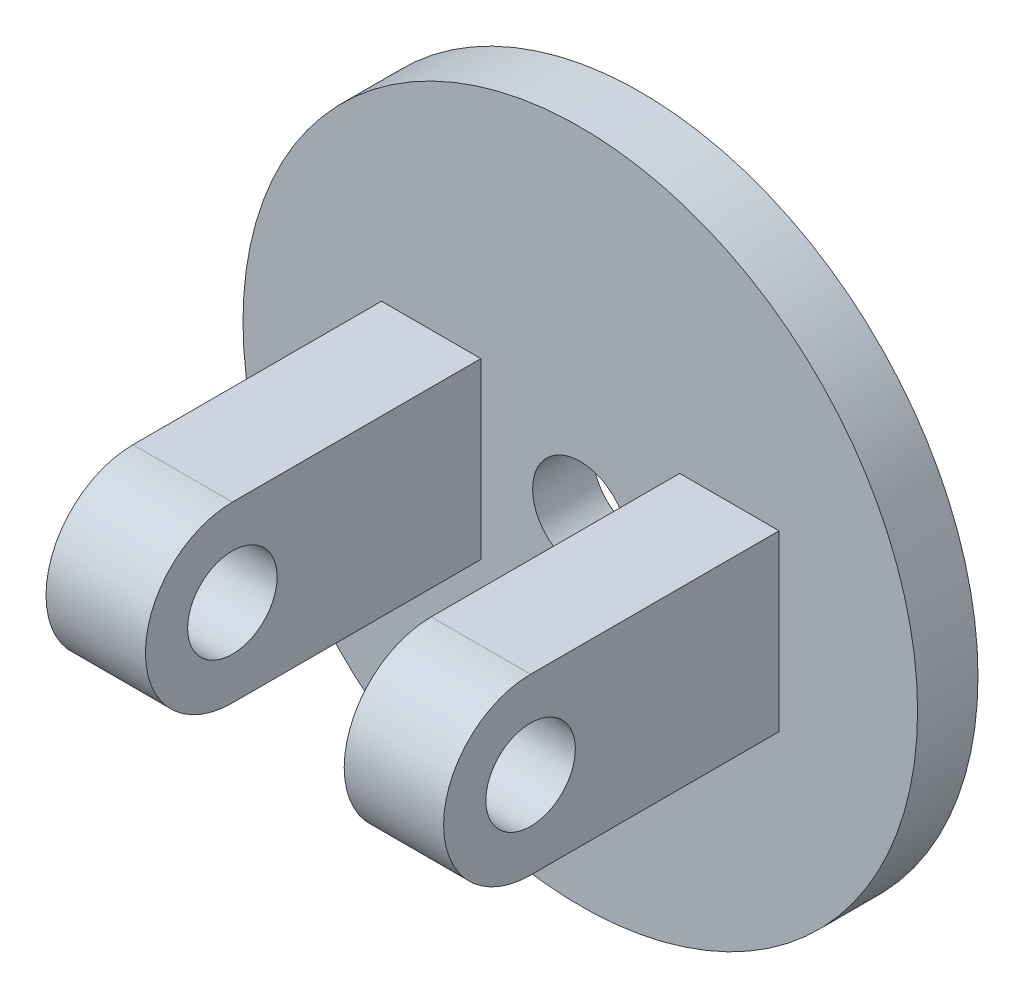
from build123d import *

# Parameters (mm, degrees)
SKETCH5_R            = 9.589935832
CUT_EXTRUDE1_DEPTH   = 40
BOSS_EXTRUDE8_DEPTH  = 60
CIRPATTERN8_COUNT    = 24
SKETCH18_W           = 20
SKETCH18_H           = 35
BOSS_EXTRUDE9_DEPTH  = 50
SKETCH19_R           = 17.5
BOSS_EXTRUDE10_DEPTH = 20
SKETCH20_R           = 17.5
BOSS_EXTRUDE11_DEPTH = 20
SKETCH22_R           = 70
CUT_EXTRUDE3_DEPTH   = 65
SKETCH23_R           = 9
CUT_EXTRUDE4_DEPTH   = 90


with BuildPart() as part:
    # Sketch4 → Revolve1 (revolve)
    with BuildSketch(Plane(origin=(0, 0, 0), x_dir=(1, 0, 0), z_dir=(0, 1, 0))):
        Polygon((0, 0), (0, -18.450154162), (67.865602024, -18.450154162), (67.865602024, 58.705035971), (49.02838169, 58.705035971), (49.02838169, 0), align=None)
    revolve(axis=Axis((0, 0, -85.541623844), (0, 0, 1)))

    # Sketch5 → Cut-Extrude1 (cut)
    with BuildSketch(Plane(origin=(0, 0, 0), x_dir=(-1, 0, 0), z_dir=(0, 0, -1))):
        Circle(SKETCH5_R)
    extrude(amount=-CUT_EXTRUDE1_DEPTH, mode=Mode.SUBTRACT)

    # Sketch18 → Boss-Extrude9 (add)
    with BuildSketch(Plane.XY.offset(18.450154162)):
        with Locations((-30, 0)):
            Rectangle(SKETCH18_W, SKETCH18_H)
        with Locations((30, 0)):
            Rectangle(SKETCH18_W, SKETCH18_H)
    extrude(amount=BOSS_EXTRUDE9_DEPTH)

    # Sketch19 → Boss-Extrude10 (add)
    with BuildSketch(Plane(origin=(-20, 0, 0), x_dir=(0, 0, -1), z_dir=(1, 0, 0))):
        with Locations((-68.450154162, 0)):
            Circle(SKETCH19_R)
    extrude(amount=-BOSS_EXTRUDE10_DEPTH)

    # Sketch20 → Boss-Extrude11 (add)
    with BuildSketch(Plane(origin=(40, 0, 0), x_dir=(0, 0, -1), z_dir=(1, 0, 0))):
        with Locations((-68.450154162, 0)):
            Circle(SKETCH20_R)
    extrude(amount=-BOSS_EXTRUDE11_DEPTH)


with BuildPart() as body_2:
    # Sketch6 → Boss-Extrude8 (new body)
    with BuildSketch(Plane(origin=(0, 0, -58.705035971), x_dir=(-1, 0, 0), z_dir=(0, 0, -1))):
        Polygon((-8.362087214, 48.310016649), (-5.897089184, 44.631705328), (-3.61276171, 45.181148209), (-2.68200751, 48.954969583), align=None)
    extrude(amount=-BOSS_EXTRUDE8_DEPTH)


with BuildPart() as cirpattern8_1:
    # CirPattern8: pattern copy
    add(body_2.part.rotate(Axis((0, 0, 18.450154162), (0, 0, -1)), 1 * 360 / CIRPATTERN8_COUNT))


with BuildPart() as cirpattern8_2:
    # CirPattern8: pattern copy
    add(body_2.part.rotate(Axis((0, 0, 18.450154162), (0, 0, -1)), 2 * 360 / CIRPATTERN8_COUNT))


with BuildPart() as cirpattern8_3:
    # CirPattern8: pattern copy
    add(body_2.part.rotate(Axis((0, 0, 18.450154162), (0, 0, -1)), 3 * 360 / CIRPATTERN8_COUNT))


with BuildPart() as cirpattern8_4:
    # CirPattern8: pattern copy
    add(body_2.part.rotate(Axis((0, 0, 18.450154162), (0, 0, -1)), 4 * 360 / CIRPATTERN8_COUNT))


with BuildPart() as cirpattern8_5:
    # CirPattern8: pattern copy
    add(body_2.part.rotate(Axis((0, 0, 18.450154162), (0, 0, -1)), 5 * 360 / CIRPATTERN8_COUNT))


with BuildPart() as cirpattern8_6:
    # CirPattern8: pattern copy
    add(body_2.part.rotate(Axis((0, 0, 18.450154162), (0, 0, -1)), 6 * 360 / CIRPATTERN8_COUNT))


with BuildPart() as cirpattern8_7:
    # CirPattern8: pattern copy
    add(body_2.part.rotate(Axis((0, 0, 18.450154162), (0, 0, -1)), 7 * 360 / CIRPATTERN8_COUNT))


with BuildPart() as cirpattern8_8:
    # CirPattern8: pattern copy
    add(body_2.part.rotate(Axis((0, 0, 18.450154162), (0, 0, -1)), 8 * 360 / CIRPATTERN8_COUNT))


with BuildPart() as cirpattern8_9:
    # CirPattern8: pattern copy
    add(body_2.part.rotate(Axis((0, 0, 18.450154162), (0, 0, -1)), 9 * 360 / CIRPATTERN8_COUNT))


with BuildPart() as cirpattern8_10:
    # CirPattern8: pattern copy
    add(body_2.part.rotate(Axis((0, 0, 18.450154162), (0, 0, -1)), 10 * 360 / CIRPATTERN8_COUNT))


with BuildPart() as cirpattern8_11:
    # CirPattern8: pattern copy
    add(body_2.part.rotate(Axis((0, 0, 18.450154162), (0, 0, -1)), 11 * 360 / CIRPATTERN8_COUNT))


with BuildPart() as cirpattern8_12:
    # CirPattern8: pattern copy
    add(body_2.part.rotate(Axis((0, 0, 18.450154162), (0, 0, -1)), 12 * 360 / CIRPATTERN8_COUNT))


with BuildPart() as cirpattern8_13:
    # CirPattern8: pattern copy
    add(body_2.part.rotate(Axis((0, 0, 18.450154162), (0, 0, -1)), 13 * 360 / CIRPATTERN8_COUNT))


with BuildPart() as cirpattern8_14:
    # CirPattern8: pattern copy
    add(body_2.part.rotate(Axis((0, 0, 18.450154162), (0, 0, -1)), 14 * 360 / CIRPATTERN8_COUNT))


with BuildPart() as cirpattern8_15:
    # CirPattern8: pattern copy
    add(body_2.part.rotate(Axis((0, 0, 18.450154162), (0, 0, -1)), 15 * 360 / CIRPATTERN8_COUNT))


with BuildPart() as cirpattern8_16:
    # CirPattern8: pattern copy
    add(body_2.part.rotate(Axis((0, 0, 18.450154162), (0, 0, -1)), 16 * 360 / CIRPATTERN8_COUNT))


with BuildPart() as cirpattern8_17:
    # CirPattern8: pattern copy
    add(body_2.part.rotate(Axis((0, 0, 18.450154162), (0, 0, -1)), 17 * 360 / CIRPATTERN8_COUNT))


with BuildPart() as cirpattern8_18:
    # CirPattern8: pattern copy
    add(body_2.part.rotate(Axis((0, 0, 18.450154162), (0, 0, -1)), 18 * 360 / CIRPATTERN8_COUNT))


with BuildPart() as cirpattern8_19:
    # CirPattern8: pattern copy
    add(body_2.part.rotate(Axis((0, 0, 18.450154162), (0, 0, -1)), 19 * 360 / CIRPATTERN8_COUNT))


with BuildPart() as cirpattern8_20:
    # CirPattern8: pattern copy
    add(body_2.part.rotate(Axis((0, 0, 18.450154162), (0, 0, -1)), 20 * 360 / CIRPATTERN8_COUNT))


with BuildPart() as cirpattern8_21:
    # CirPattern8: pattern copy
    add(body_2.part.rotate(Axis((0, 0, 18.450154162), (0, 0, -1)), 21 * 360 / CIRPATTERN8_COUNT))


with BuildPart() as cirpattern8_22:
    # CirPattern8: pattern copy
    add(body_2.part.rotate(Axis((0, 0, 18.450154162), (0, 0, -1)), 22 * 360 / CIRPATTERN8_COUNT))


with BuildPart() as cirpattern8_23:
    # CirPattern8: pattern copy
    add(body_2.part.rotate(Axis((0, 0, 18.450154162), (0, 0, -1)), 23 * 360 / CIRPATTERN8_COUNT))


with BuildPart() as cut_extrude3_tool:
    # Sketch22 → Cut-Extrude3 (new body)
    with BuildSketch(Plane(origin=(0, 0, -58.705035971), x_dir=(-1, 0, 0), z_dir=(0, 0, -1))):
        Circle(SKETCH22_R)
    extrude(amount=-CUT_EXTRUDE3_DEPTH)


with BuildPart() as part_1:
    add(part.part)

    # Cut-Extrude3: cut by cut_extrude3_tool
    add(cut_extrude3_tool.part, mode=Mode.SUBTRACT)

    # Sketch23 → Cut-Extrude4 (cut)
    with BuildSketch(Plane(origin=(40, 0, 0), x_dir=(0, 0, -1), z_dir=(1, 0, 0))):
        with Locations((-68.450154162, 0)):
            Circle(SKETCH23_R)
    extrude(amount=-CUT_EXTRUDE4_DEPTH, mode=Mode.SUBTRACT)


with BuildPart() as body_2_1:
    add(body_2.part)

    # Cut-Extrude3: cut by cut_extrude3_tool
    add(cut_extrude3_tool.part, mode=Mode.SUBTRACT)


with BuildPart() as cirpattern8_1_1:
    add(cirpattern8_1.part)

    # Cut-Extrude3: cut by cut_extrude3_tool
    add(cut_extrude3_tool.part, mode=Mode.SUBTRACT)


with BuildPart() as cirpattern8_2_1:
    add(cirpattern8_2.part)

    # Cut-Extrude3: cut by cut_extrude3_tool
    add(cut_extrude3_tool.part, mode=Mode.SUBTRACT)


with BuildPart() as cirpattern8_3_1:
    add(cirpattern8_3.part)

    # Cut-Extrude3: cut by cut_extrude3_tool
    add(cut_extrude3_tool.part, mode=Mode.SUBTRACT)


with BuildPart() as cirpattern8_4_1:
    add(cirpattern8_4.part)

    # Cut-Extrude3: cut by cut_extrude3_tool
    add(cut_extrude3_tool.part, mode=Mode.SUBTRACT)


with BuildPart() as cirpattern8_5_1:
    add(cirpattern8_5.part)

    # Cut-Extrude3: cut by cut_extrude3_tool
    add(cut_extrude3_tool.part, mode=Mode.SUBTRACT)


with BuildPart() as cirpattern8_6_1:
    add(cirpattern8_6.part)

    # Cut-Extrude3: cut by cut_extrude3_tool
    add(cut_extrude3_tool.part, mode=Mode.SUBTRACT)


with BuildPart() as cirpattern8_7_1:
    add(cirpattern8_7.part)

    # Cut-Extrude3: cut by cut_extrude3_tool
    add(cut_extrude3_tool.part, mode=Mode.SUBTRACT)


with BuildPart() as cirpattern8_8_1:
    add(cirpattern8_8.part)

    # Cut-Extrude3: cut by cut_extrude3_tool
    add(cut_extrude3_tool.part, mode=Mode.SUBTRACT)


with BuildPart() as cirpattern8_9_1:
    add(cirpattern8_9.part)

    # Cut-Extrude3: cut by cut_extrude3_tool
    add(cut_extrude3_tool.part, mode=Mode.SUBTRACT)


with BuildPart() as cirpattern8_10_1:
    add(cirpattern8_10.part)

    # Cut-Extrude3: cut by cut_extrude3_tool
    add(cut_extrude3_tool.part, mode=Mode.SUBTRACT)


with BuildPart() as cirpattern8_11_1:
    add(cirpattern8_11.part)

    # Cut-Extrude3: cut by cut_extrude3_tool
    add(cut_extrude3_tool.part, mode=Mode.SUBTRACT)


with BuildPart() as cirpattern8_12_1:
    add(cirpattern8_12.part)

    # Cut-Extrude3: cut by cut_extrude3_tool
    add(cut_extrude3_tool.part, mode=Mode.SUBTRACT)


with BuildPart() as cirpattern8_13_1:
    add(cirpattern8_13.part)

    # Cut-Extrude3: cut by cut_extrude3_tool
    add(cut_extrude3_tool.part, mode=Mode.SUBTRACT)


with BuildPart() as cirpattern8_14_1:
    add(cirpattern8_14.part)

    # Cut-Extrude3: cut by cut_extrude3_tool
    add(cut_extrude3_tool.part, mode=Mode.SUBTRACT)


with BuildPart() as cirpattern8_15_1:
    add(cirpattern8_15.part)

    # Cut-Extrude3: cut by cut_extrude3_tool
    add(cut_extrude3_tool.part, mode=Mode.SUBTRACT)


with BuildPart() as cirpattern8_16_1:
    add(cirpattern8_16.part)

    # Cut-Extrude3: cut by cut_extrude3_tool
    add(cut_extrude3_tool.part, mode=Mode.SUBTRACT)


with BuildPart() as cirpattern8_17_1:
    add(cirpattern8_17.part)

    # Cut-Extrude3: cut by cut_extrude3_tool
    add(cut_extrude3_tool.part, mode=Mode.SUBTRACT)


with BuildPart() as cirpattern8_18_1:
    add(cirpattern8_18.part)

    # Cut-Extrude3: cut by cut_extrude3_tool
    add(cut_extrude3_tool.part, mode=Mode.SUBTRACT)


with BuildPart() as cirpattern8_19_1:
    add(cirpattern8_19.part)

    # Cut-Extrude3: cut by cut_extrude3_tool
    add(cut_extrude3_tool.part, mode=Mode.SUBTRACT)


with BuildPart() as cirpattern8_20_1:
    add(cirpattern8_20.part)

    # Cut-Extrude3: cut by cut_extrude3_tool
    add(cut_extrude3_tool.part, mode=Mode.SUBTRACT)


with BuildPart() as cirpattern8_21_1:
    add(cirpattern8_21.part)

    # Cut-Extrude3: cut by cut_extrude3_tool
    add(cut_extrude3_tool.part, mode=Mode.SUBTRACT)


with BuildPart() as cirpattern8_22_1:
    add(cirpattern8_22.part)

    # Cut-Extrude3: cut by cut_extrude3_tool
    add(cut_extrude3_tool.part, mode=Mode.SUBTRACT)


with BuildPart() as cirpattern8_23_1:
    add(cirpattern8_23.part)

    # Cut-Extrude3: cut by cut_extrude3_tool
    add(cut_extrude3_tool.part, mode=Mode.SUBTRACT)


solid = part_1.part
